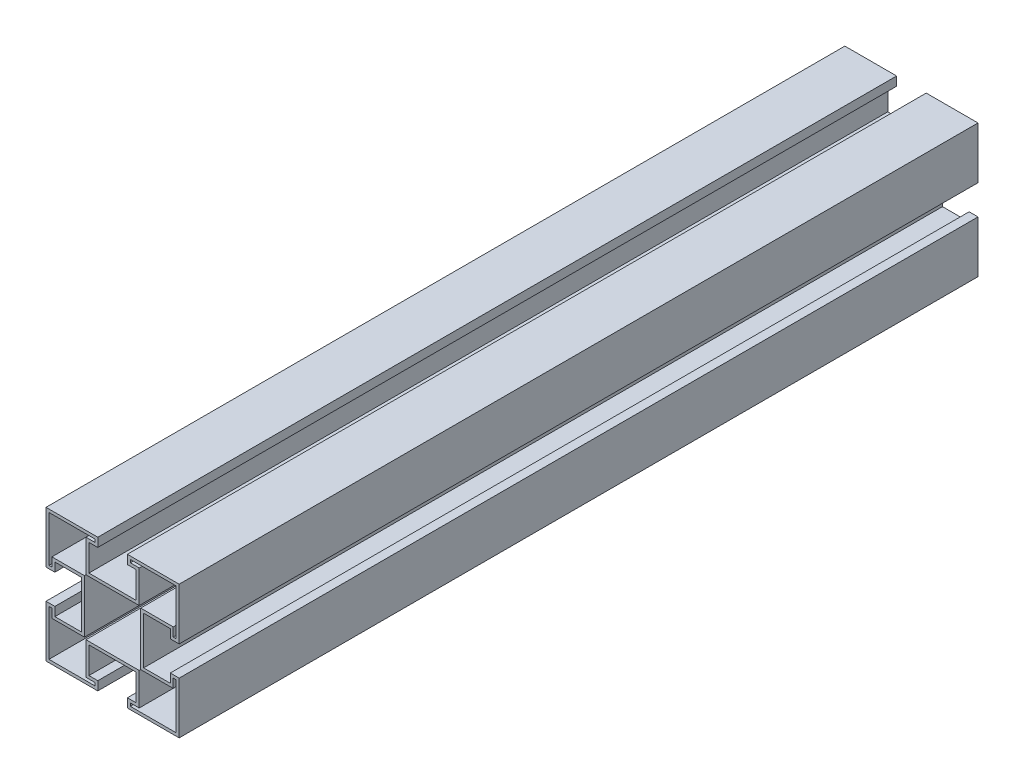
from build123d import *

# Parameters (mm, degrees)
BOSS_EXTRUDE2_DEPTH = 135


with BuildPart() as part:
    # Sketch1 → Boss-Extrude2 (new, symmetric)
    with BuildSketch(Plane.XY):
        Polygon((-5, 22.5), (-5, 19.5), (-8, 19.5), (-8, 10.5), (8, 10.5), (8, 19.5), (5, 19.5), (5, 22.5), (22.5, 22.5), (22.5, 5), (19.5, 5), (19.5, 8), (10.5, 8), (10.5, -8), (19.5, -8), (19.5, -5), (22.5, -5), (22.5, -22.5), (5, -22.5), (5, -19.5), (8, -19.5), (8, -10.5), (-8, -10.5), (-8, -19.5), (-5, -19.5), (-5, -22.5), (-22.5, -22.5), (-22.5, -5), (-19.5, -5), (-19.5, -8), (-10.5, -8), (-10.5, 8), (-19.5, 8), (-19.5, 5), (-22.5, 5), (-22.5, 22.5), align=None)
        Polygon((-6, 21.5), (-21.5, 21.5), (-21.5, 6), (-20.5, 6), (-20.5, 9), (-9.5, 9), (-9.5, -9), (-20.5, -9), (-20.5, -6), (-21.5, -6), (-21.5, -21.5), (-6, -21.5), (-6, -20.5), (-9, -20.5), (-9, -9.5), (9, -9.5), (9, -20.5), (6, -20.5), (6, -21.5), (21.5, -21.5), (21.5, -6), (20.5, -6), (20.5, -9), (9.5, -9), (9.5, 9), (20.5, 9), (20.5, 6), (21.5, 6), (21.5, 21.5), (6, 21.5), (6, 20.5), (9, 20.5), (9, 9.5), (-9, 9.5), (-9, 20.5), (-6, 20.5), align=None, mode=Mode.SUBTRACT)
    extrude(amount=BOSS_EXTRUDE2_DEPTH, both=True)


solid = part.part
